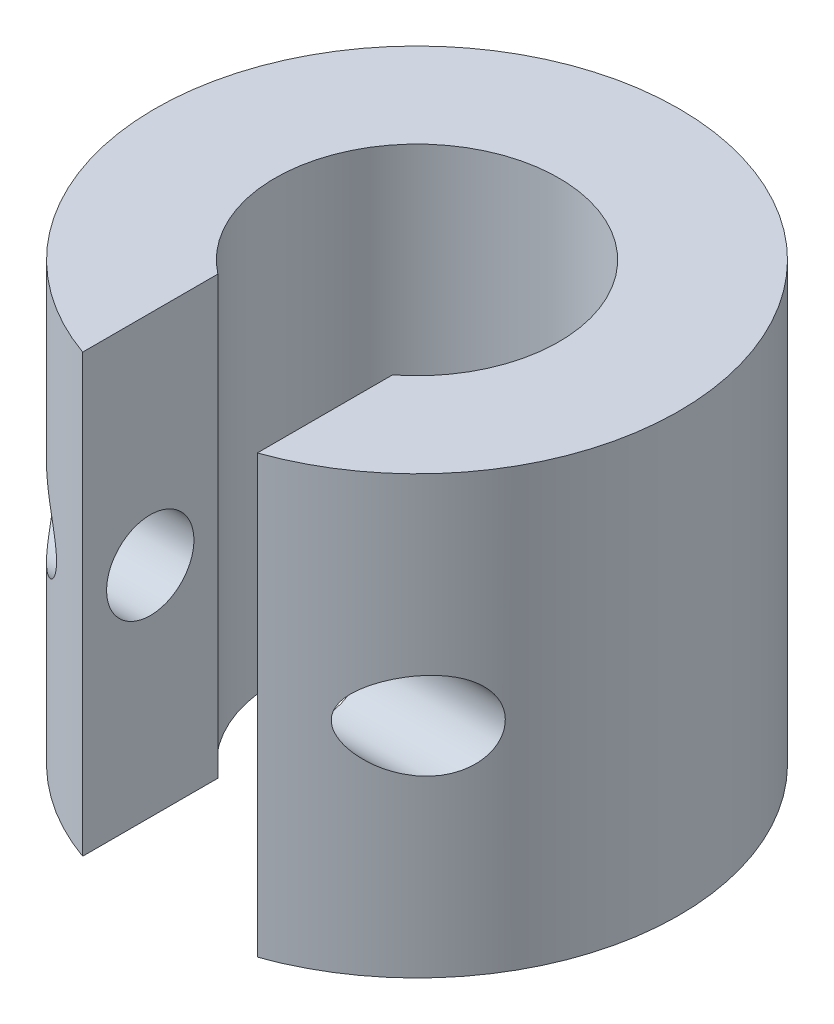
from build123d import *

# Parameters (mm, degrees)
BOSS_EXTRUDE1_DEPTH     = 10
CUT_EXTRUDE1_DEPTH      = 10
CUT_EXTRUDE1_DEPTH_BACK = 10
SKETCH2_R               = 1


with BuildPart() as part:
    # Sketch1 → Boss-Extrude1 (new body)
    with BuildSketch(Plane(origin=(0, 0, 0), x_dir=(1, 0, 0), z_dir=(0, 1, 0))):
        with BuildLine():
            Line((-5.862008202, 2.231502929), (-5.862008202, 5.326619487))
            ThreePointArc((-5.862008202, 5.326619487), (-5.287227483, 10.80918754), (-0.612008202, 7.888357178))
            ThreePointArc((-0.612008202, 7.888357178), (-0.941177841, 6.463137897), (-1.862008202, 5.326619487))
            Line((-1.862008202, 5.326619487), (-1.862008202, 2.231502929))
            ThreePointArc((-1.862008202, 2.231502929), (1.036971284, 4.424255563), (2.137991798, 7.888357178))
            ThreePointArc((2.137991798, 7.888357178), (-7.326109817, 12.787336664), (-5.862008202, 2.231502929))
        make_face()
    extrude(amount=BOSS_EXTRUDE1_DEPTH)

    # Sketch2 → Cut-Extrude1 (cut, two sides: drawn at the far end of the back side and taken through both)
    with BuildSketch(Plane(origin=(-5.862008202, 0, 0), x_dir=(0, 0, -1), z_dir=(1, 0, 0)).offset(-CUT_EXTRUDE1_DEPTH_BACK)):
        with Locations(Location((3.779061208, 5, 0), (0, 0, 180))):
            Circle(SKETCH2_R)
    extrude(amount=CUT_EXTRUDE1_DEPTH + CUT_EXTRUDE1_DEPTH_BACK, mode=Mode.SUBTRACT)


solid = part.part
